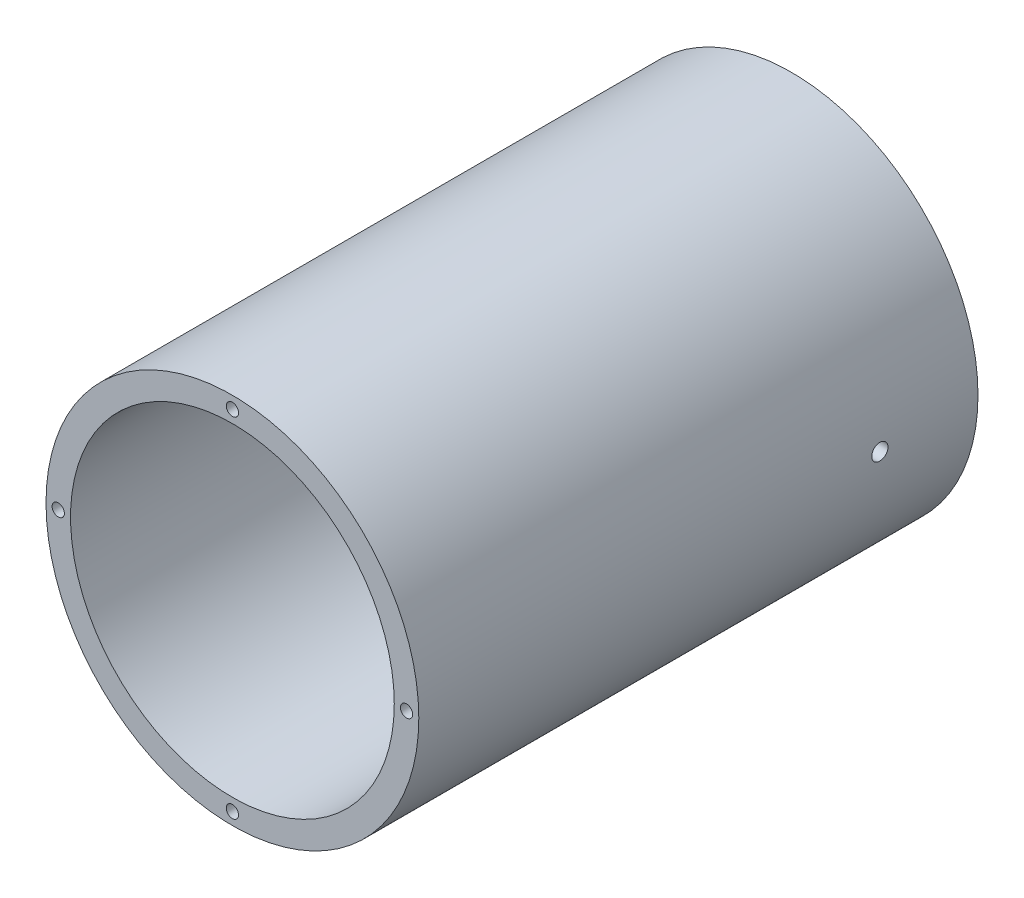
from build123d import *

# Parameters (mm, degrees)
SKETCH_1_R                   = 38
SKETCH_1_R_2                 = 33
EXTRUDE_1_DEPTH              = 57
HOLE_WIZARD_M3_1_D           = 2.5
HOLE_WIZARD_M3_1_DEPTH       = 8.5
HOLE_WIZARD_M3_1_TIP         = 0.751075774
HOLE_WIZARD_M3_3_D           = 2.5
HOLE_WIZARD_M3_3_DEPTH       = 8.5
HOLE_WIZARD_M3_3_TIP         = 0.751075774
HOLE_WIZARD_M4_1_D           = 3.3
HOLE_WIZARD_M4_1_ON_FACE_2_D = 3.3


with BuildPart() as part:
    # 草图1 → 凸台-拉伸1 (new, symmetric)
    with BuildSketch(Plane.XY):
        with Locations(Location((0, 0, 0), (0, 0, 180))):
            Circle(SKETCH_1_R)
        with Locations(Location((0, 0, 0), (0, 0, 180))):
            Circle(SKETCH_1_R_2, mode=Mode.SUBTRACT)
    extrude(amount=EXTRUDE_1_DEPTH, both=True)

    # M3 螺纹孔1
    with Locations(Plane.XY.offset(57)):
        with Locations((0, 35.5), (35.5, 0), (0, -35.5), (-35.5, 0)):
            Hole(HOLE_WIZARD_M3_1_D / 2, depth=HOLE_WIZARD_M3_1_DEPTH)
            with Locations((0, 0, -(HOLE_WIZARD_M3_1_DEPTH + HOLE_WIZARD_M3_1_TIP / 2))):  # 118° drill point
                Cone(0, HOLE_WIZARD_M3_1_D / 2, HOLE_WIZARD_M3_1_TIP, mode=Mode.SUBTRACT)

    # M3 螺纹孔3
    with Locations(Plane(origin=(13.806274772, 28.987165745, -57), x_dir=(-1, 0, 0), z_dir=(0, 0, -1))):
        with Locations((49.306274772, -28.987165745), (13.806274772, -64.487165745), (-21.693725228, -28.987165745), (13.806274772, 6.512834255)):
            Hole(HOLE_WIZARD_M3_3_D / 2, depth=HOLE_WIZARD_M3_3_DEPTH)
            with Locations((0, 0, -(HOLE_WIZARD_M3_3_DEPTH + HOLE_WIZARD_M3_3_TIP / 2))):  # 118° drill point
                Cone(0, HOLE_WIZARD_M3_3_D / 2, HOLE_WIZARD_M3_3_TIP, mode=Mode.SUBTRACT)

    # M4 螺纹孔1 (through all)
    with Locations(Plane(origin=(38, 0, -37), x_dir=(0, 1, 0), z_dir=(1, 0, 0))):
        with Locations((0, 0)):
            Hole(HOLE_WIZARD_M4_1_D / 2)

    # M4 螺纹孔1 on face 2 (through all)
    with Locations(Plane(origin=(-38, 0, -37), x_dir=(0, 0, -1), z_dir=(-1, 0, 0))):
        with Locations((0, 0)):
            Hole(HOLE_WIZARD_M4_1_ON_FACE_2_D / 2)


solid = part.part
